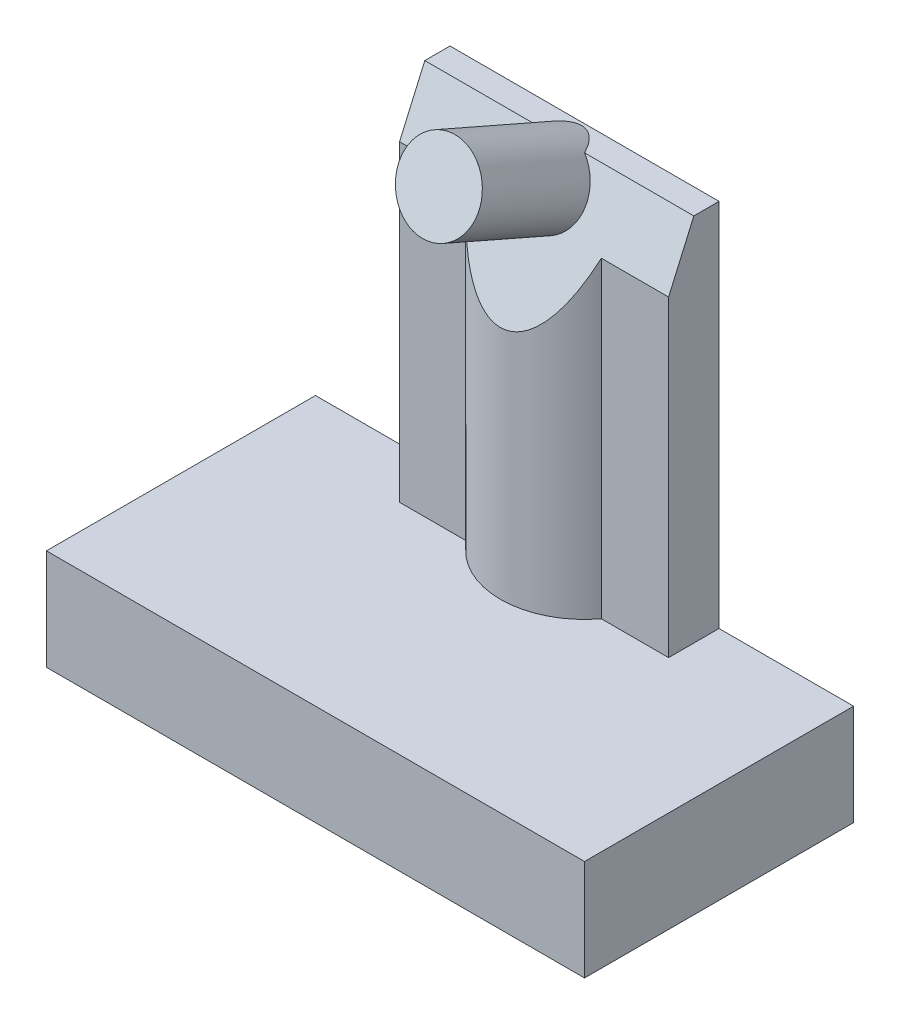
from build123d import *

# Parameters (mm, degrees)
SKETCH1_W                       = 16
SKETCH1_H                       = 8
BOSS_EXTRUDE1_DEPTH             = 3
SHELL1_T                        = -1
SKETCH2_R                       = 1.5
SKETCH2_R_2                     = 0.8
BOSS_EXTRUDE2_DEPTH             = 2
BOSS_EXTRUDE3_DEPTH             = 11
CUT_EXTRUDE1_DEPTH              = 19.867962264
CUT_EXTRUDE1_DEPTH_BACK         = 19.867962264
SKETCH6_R                       = 1.2
BOSS_EXTRUDE4_DEPTH             = 3.5
BOSS_EXTRUDE4_DIRECTION_2_REACH = 18.513


with BuildPart() as part:
    # Sketch1 → Boss-Extrude1 (new body)
    with BuildSketch(Plane(origin=(0, 0, 0), x_dir=(1, 0, 0), z_dir=(0, 1, 0))):
        Rectangle(SKETCH1_W, SKETCH1_H)
    extrude(amount=BOSS_EXTRUDE1_DEPTH)

    # Shell1
    shell1_openings = [part.faces().sort_by_distance(p)[0] for p in [
        (0, 0, 0),
    ]]
    offset(amount=SHELL1_T, openings=shell1_openings, kind=Kind.INTERSECTION)

    # Sketch2 → Boss-Extrude2 (add)
    with BuildSketch(Plane.XZ.offset(-2)):
        with Locations(Location((0, 0, 0), (0, 0, 270))):
            Circle(SKETCH2_R)
        with Locations(Location((0, 0, 0), (0, 0, 270))):
            Circle(SKETCH2_R_2, mode=Mode.SUBTRACT)
    extrude(amount=BOSS_EXTRUDE2_DEPTH)

    # Sketch3 → Boss-Extrude3 (add)
    with BuildSketch(Plane(origin=(0, 3, 0), x_dir=(1, 0, 0), z_dir=(0, 1, 0))):
        with BuildLine():
            Line((-4, 4), (4, 4))
            Line((4, 4), (4, 2.5))
            Line((4, 2.5), (2, 2.5))
            ThreePointArc((2, 2.5), (0, 1.5), (-2, 2.5))
            Line((-2, 2.5), (-4, 2.5))
            Line((-4, 2.5), (-4, 4))
        make_face()
    extrude(amount=BOSS_EXTRUDE3_DEPTH)

    # Sketch4 → Cut-Extrude1 (cut, two sides: drawn at the far end of the back side and taken through both)
    with BuildSketch(Plane(origin=(4, 0, 0), x_dir=(0, 0, -1), z_dir=(1, 0, 0)).offset(-CUT_EXTRUDE1_DEPTH_BACK)):
        Polygon((3.25, 14), (1.5, 14), (1.5, 10), align=None)
    extrude(amount=CUT_EXTRUDE1_DEPTH + CUT_EXTRUDE1_DEPTH_BACK, mode=Mode.SUBTRACT)

    # Sketch6 → Boss-Extrude4 (add)
    with BuildSketch(Plane(origin=(0, 1.055737705, 2.413114754), x_dir=(1, 0, 0), z_dir=(0, 0.4008188340197082, 0.9161573349021889))):
        with Locations(Location((0, 13.193279121, 0), (0, 0, 270))):
            Circle(SKETCH6_R)
    extrude(amount=BOSS_EXTRUDE4_DEPTH)

    # Sketch6 → Boss-Extrude4 direction 2 (add, up to next)
    with BuildSketch(Plane(origin=(0, 1.055737705, 2.413114754), x_dir=(1, 0, 0), z_dir=(0, 0.4008188340197082, 0.9161573349021889)), mode=Mode.PRIVATE) as boss_extrude4_direction_2_sk1:
        with Locations(Location((0, 13.193279121, 0), (0, 0, 270))):
            Circle(SKETCH6_R)
    boss_extrude4_direction_2_tool1 = extrude(boss_extrude4_direction_2_sk1.sketch, amount=-BOSS_EXTRUDE4_DIRECTION_2_REACH, mode=Mode.PRIVATE) - part.part
    add(boss_extrude4_direction_2_tool1.solids().sort_by_distance((0, 13.142857, -2.875))[0])


solid = part.part
